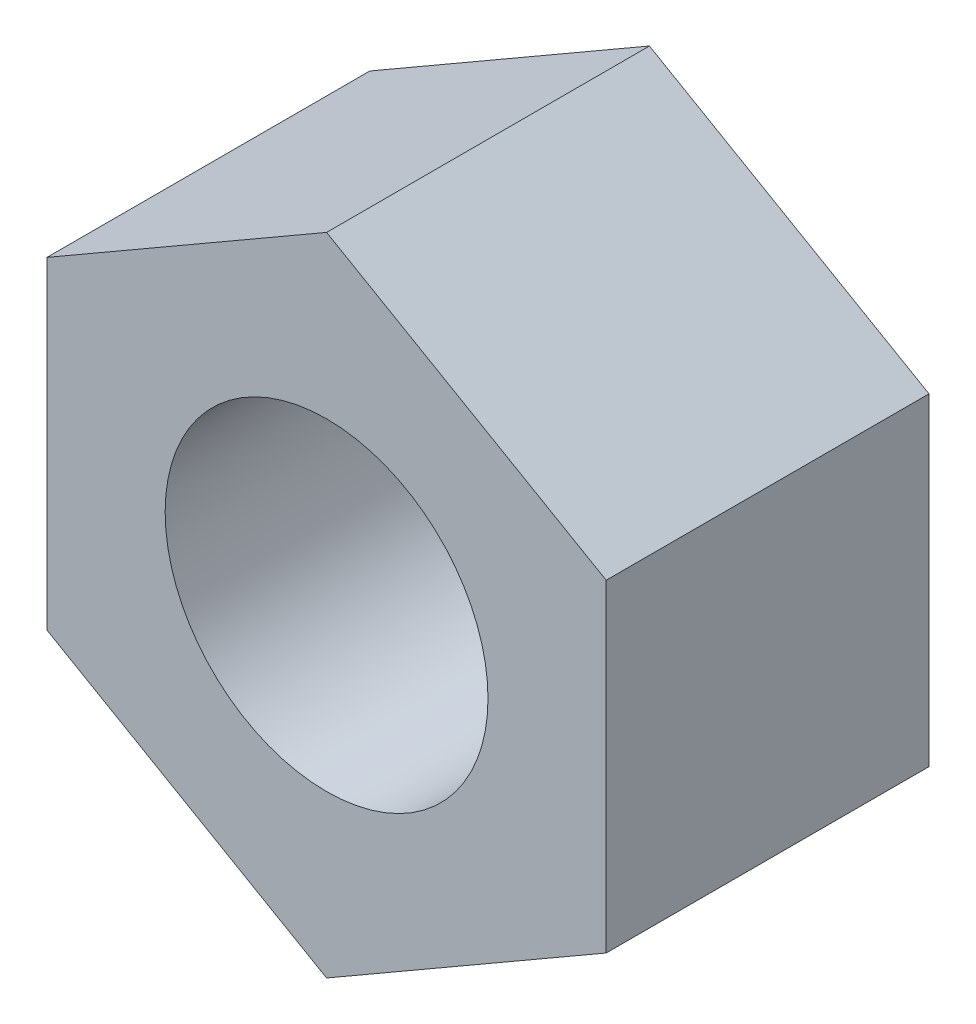
from build123d import *

# Parameters (mm, degrees)
BOSS_EXTRUDE1_DEPTH = 2
SKETCH2_R           = 1
CUT_EXTRUDE1_DEPTH  = 3


with BuildPart() as part:
    # Sketch1 → Boss-Extrude1 (new body)
    with BuildSketch(Plane.XY):
        Polygon((0, 2), (-1.732050808, 1), (-1.732050808, -1), (0, -2), (1.732050808, -1), (1.732050808, 1), align=None)
    extrude(amount=BOSS_EXTRUDE1_DEPTH)

    # Sketch2 → Cut-Extrude1 (cut)
    with BuildSketch(Plane(origin=(0, 0, 0), x_dir=(-1, 0, 0), z_dir=(0, 0, -1))):
        Circle(SKETCH2_R)
    extrude(amount=-CUT_EXTRUDE1_DEPTH, mode=Mode.SUBTRACT)


solid = part.part
